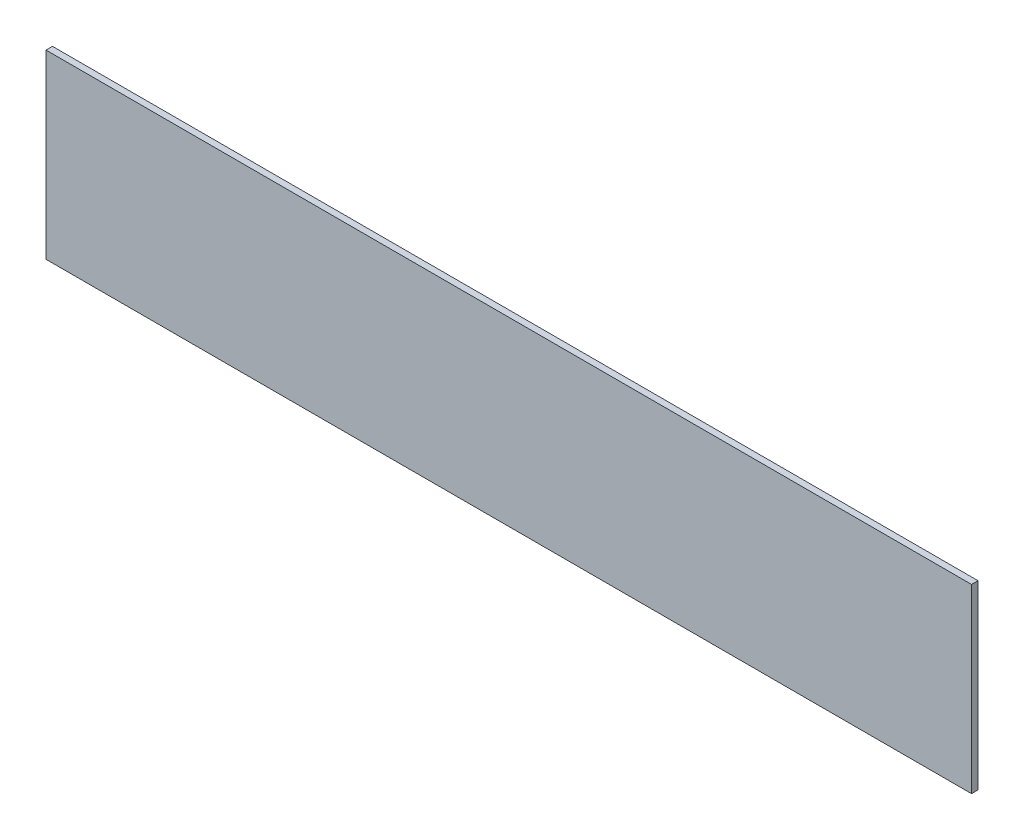
from build123d import *

# Parameters (mm, degrees)
SKETCH1_W           = 454.025
SKETCH1_H           = 88.9
BOSS_EXTRUDE1_DEPTH = 1.5875


with BuildPart() as part:
    # Sketch1 → Boss-Extrude1 (new, symmetric)
    with BuildSketch(Plane.XY):
        Rectangle(SKETCH1_W, SKETCH1_H)
    extrude(amount=BOSS_EXTRUDE1_DEPTH, both=True)


solid = part.part
